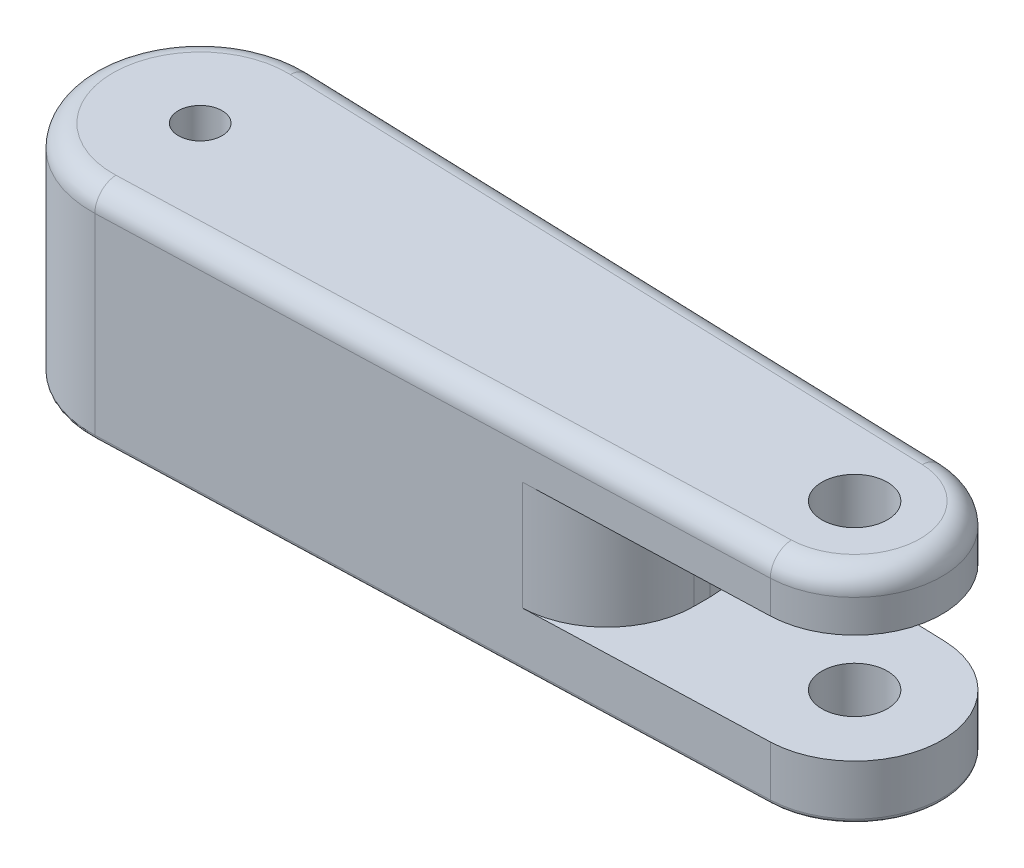
from build123d import *

# Parameters (mm, degrees)
SALIENTE_EXTRUIR1_DEPTH      = 25
SALIENTE_EXTRUIR1_DEPTH_BACK = 25
CROQUIS1_R                   = 5
REDONDEO9_R                  = 1
CORTAR_EXTRUIR1_DEPTH        = 49
CORTAR_EXTRUIR1_DEPTH_BACK   = 47
CROQUIS3_W                   = 70
CROQUIS3_H                   = 25
REDONDEO10_R                 = 20
CROQUIS4_R                   = 7.5
CORTAR_EXTRUIR2_DEPTH        = 65
REDONDEO11_R                 = 5


with BuildPart() as part:
    # Croquis1 → Saliente-Extruir1 (new, two sides: drawn at the far end of the back side and taken through both)
    with BuildSketch(Plane(origin=(0, 0, 0), x_dir=(1, 0, 0), z_dir=(0, 1, 0)).offset(-SALIENTE_EXTRUIR1_DEPTH_BACK)):
        with BuildLine():
            Line((-149.166666667, 24.986107251), (0.666666667, 19.988885801))
            ThreePointArc((0.666666667, 19.988885801), (20, 0), (0.666666667, -19.988885801))
            Line((0.666666667, -19.988885801), (-149.166666667, -24.986107251))
            ThreePointArc((-149.166666667, -24.986107251), (-175, 0), (-149.166666667, 24.986107251))
        make_face()
        with Locations((-150, 0)):
            Circle(CROQUIS1_R, mode=Mode.SUBTRACT)
    extrude(amount=SALIENTE_EXTRUIR1_DEPTH + SALIENTE_EXTRUIR1_DEPTH_BACK)

    # Redondeo9
    redondeo9_edges = [part.edges().sort_by_distance(p)[0] for p in [
        (-175, -25, 0),
        (-74.25, -25, -22.487496526),
        (20, -25, 0),
        (-74.25, -25, 22.487496526),
    ]]
    fillet(redondeo9_edges, radius=REDONDEO9_R)

    # Croquis3 → Cortar-Extruir1 (cut, two sides: drawn at the far end of the back side and taken through both)
    with BuildSketch(Plane.XY.offset(-CORTAR_EXTRUIR1_DEPTH_BACK)):
        Rectangle(CROQUIS3_W, CROQUIS3_H)
    extrude(amount=CORTAR_EXTRUIR1_DEPTH + CORTAR_EXTRUIR1_DEPTH_BACK, mode=Mode.SUBTRACT)

    # Redondeo10
    redondeo10_edges = [part.edges().sort_by_distance(p)[0] for p in [
        (-35, 0, -21.178435734),
        (-35, 0, 21.178435734),
    ]]
    fillet(redondeo10_edges, radius=REDONDEO10_R)

    # Croquis4 → Cortar-Extruir2 (cut)
    with BuildSketch(Plane(origin=(0, 25, 0), x_dir=(1, 0, 0), z_dir=(0, 1, 0))):
        Circle(CROQUIS4_R)
    extrude(amount=-CORTAR_EXTRUIR2_DEPTH, mode=Mode.SUBTRACT)

    # Redondeo11
    redondeo11_edges = [part.edges().sort_by_distance(p)[0] for p in [
        (20, 25, 0),
        (-74.25, 25, 22.487496526),
        (-175, 25, 0),
        (-74.25, 25, -22.487496526),
    ]]
    fillet(redondeo11_edges, radius=REDONDEO11_R)


solid = part.part
